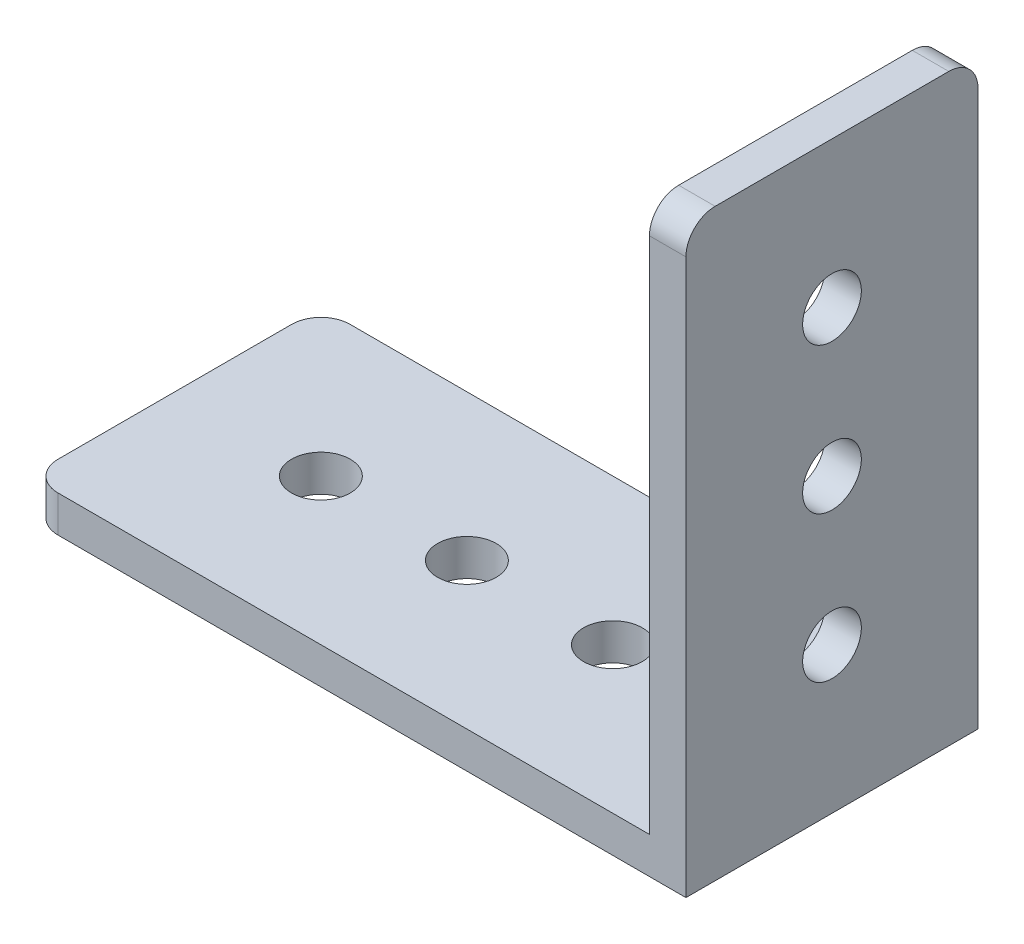
from build123d import *

# Parameters (mm, degrees)
BOSS_EXTRUDE1_DEPTH    = 25.4
FILLET1_R              = 2.54
F_10_CLEARANCE_HOLE1_D = 5.1054
F_10_CLEARANCE_HOLE2_D = 5.1054


with BuildPart() as part:
    # Sketch1 → Boss-Extrude1 (new body)
    with BuildSketch(Plane.XY):
        Polygon((0, 0), (0, 50.8), (-3.175, 50.8), (-3.175, 3.175), (-57.15, 3.175), (-57.15, 0), align=None)
    extrude(amount=BOSS_EXTRUDE1_DEPTH)

    # Fillet1
    fillet1_edges = [part.edges().sort_by_distance(p)[0] for p in [
        (-1.5875, 50.8, 25.4),
        (-57.15, 1.5875, 25.4),
        (-57.15, 1.5875, 0),
        (-1.5875, 50.8, 0),
    ]]
    fillet(fillet1_edges, radius=FILLET1_R)

    # #10 Clearance Hole1 (through all)
    with Locations(Plane.ZY.offset(3.175)):
        with Locations((12.7, 38.1), (12.7, 25.4), (12.7, 12.7)):
            Hole(F_10_CLEARANCE_HOLE1_D / 2)

    # #10 Clearance Hole2 (through all)
    with Locations(Plane(origin=(0, 3.175, 0), x_dir=(1, 0, 0), z_dir=(0, 1, 0))):
        with Locations((-19.05, -12.7), (-31.75, -12.7), (-44.45, -12.7)):
            Hole(F_10_CLEARANCE_HOLE2_D / 2)


solid = part.part
